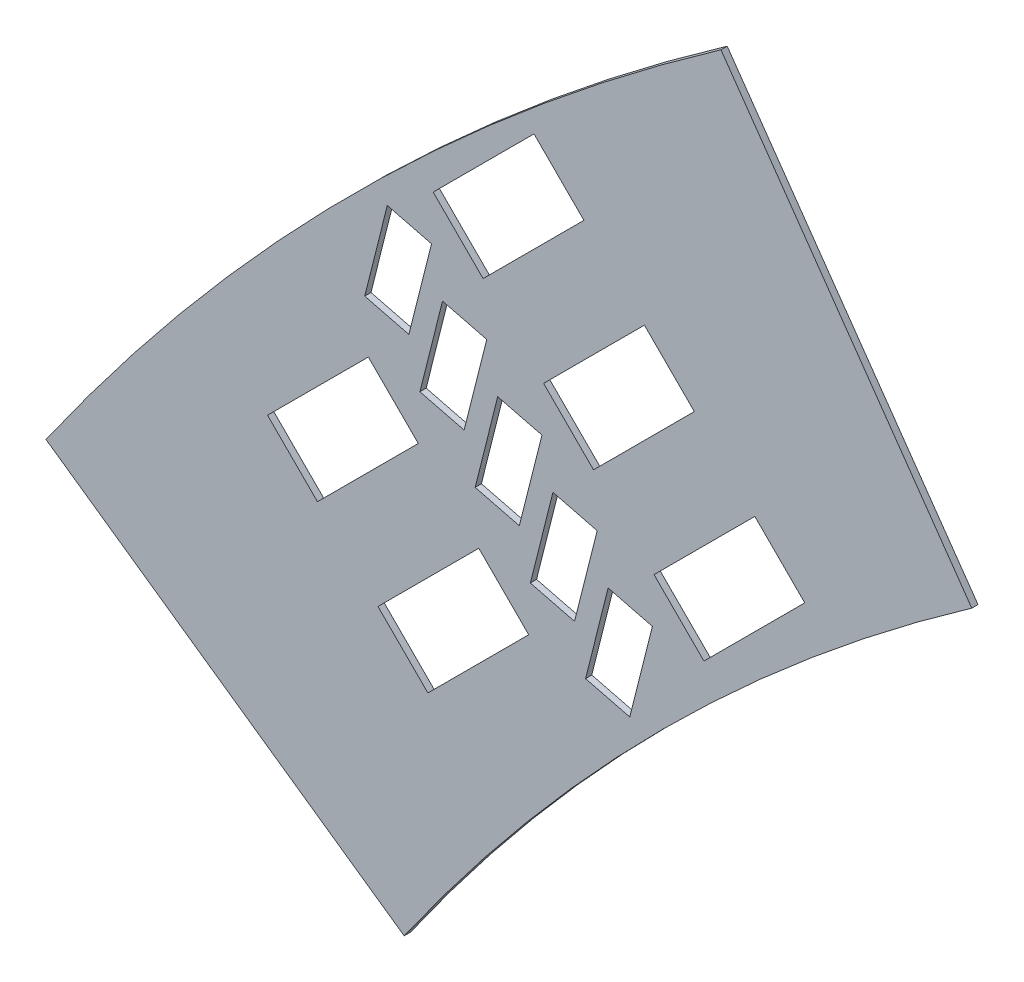
from build123d import *

# Parameters (mm, degrees)
BOSS_EXTRUDE1_DEPTH = 0.1
CUT_EXTRUDE1_DEPTH  = 102.944318085


with BuildPart() as part:
    # Sketch1 → Boss-Extrude1 (new, symmetric)
    with BuildSketch(Plane(origin=(0, 0, 0), x_dir=(0, 1, 0), z_dir=(0, 0, 1))):
        with BuildLine():
            Line((50.474726399, 72.085379897), (42.44465629, 60.617251277))
            ThreePointArc((42.44465629, 60.617251277), (52.325901808, 52.325901808), (60.617251277, 42.44465629))
            Line((60.617251277, 42.44465629), (72.085379897, 50.474726399))
            ThreePointArc((72.085379897, 50.474726399), (62.225396744, 62.225396744), (50.474726399, 72.085379897))
        make_face()
    extrude(amount=BOSS_EXTRUDE1_DEPTH, both=True)

    # Sketch2 → Cut-Extrude1 (cut, through all)
    with BuildSketch(Plane.XY.offset(0.1)):
        Polygon((-54.809835721, 52.480589816), (-54.086251462, 55.355942111), (-52.67039502, 54.999640924), (-53.393979279, 52.124288629), align=None)
        Polygon((-56.577602674, 54.248356769), (-55.854018415, 57.123709064), (-54.438161973, 56.767407877), (-55.161746232, 53.892055582), align=None)
        Polygon((-58.345369627, 56.016123722), (-57.621785368, 58.891476017), (-56.205928926, 58.53517483), (-56.929513185, 55.659822535), align=None)
        Polygon((-60.11313658, 57.783890675), (-59.389552321, 60.65924297), (-57.973695879, 60.302941783), (-58.697280138, 57.427589488), align=None)
        Polygon((-61.880903533, 59.551657628), (-61.157319274, 62.427009923), (-59.741462831, 62.070708736), (-60.465047091, 59.195356441), align=None)
        Polygon((-51.01952203, 54.862647385), (-52.617583355, 56.460708711), (-49.389640899, 59.688651167), (-47.791579573, 58.090589841), align=None)
        Polygon((-59.858356794, 49.559346526), (-56.630414338, 52.787288983), (-58.228475664, 54.385350308), (-61.45641812, 51.157407852), align=None)
        Polygon((-54.555055935, 58.398181291), (-56.153117261, 59.996242617), (-52.925174805, 63.224185073), (-51.327113479, 61.626123747), align=None)
        Polygon((-58.090589841, 61.933715197), (-59.688651167, 63.531776523), (-56.460708711, 66.759718979), (-54.862647385, 65.161657653), align=None)
        Polygon((-63.3938907, 53.094880432), (-60.165948244, 56.322822888), (-61.76400957, 57.920884214), (-64.991952026, 54.692941758), align=None)
    extrude(amount=-CUT_EXTRUDE1_DEPTH, mode=Mode.SUBTRACT)


solid = part.part
